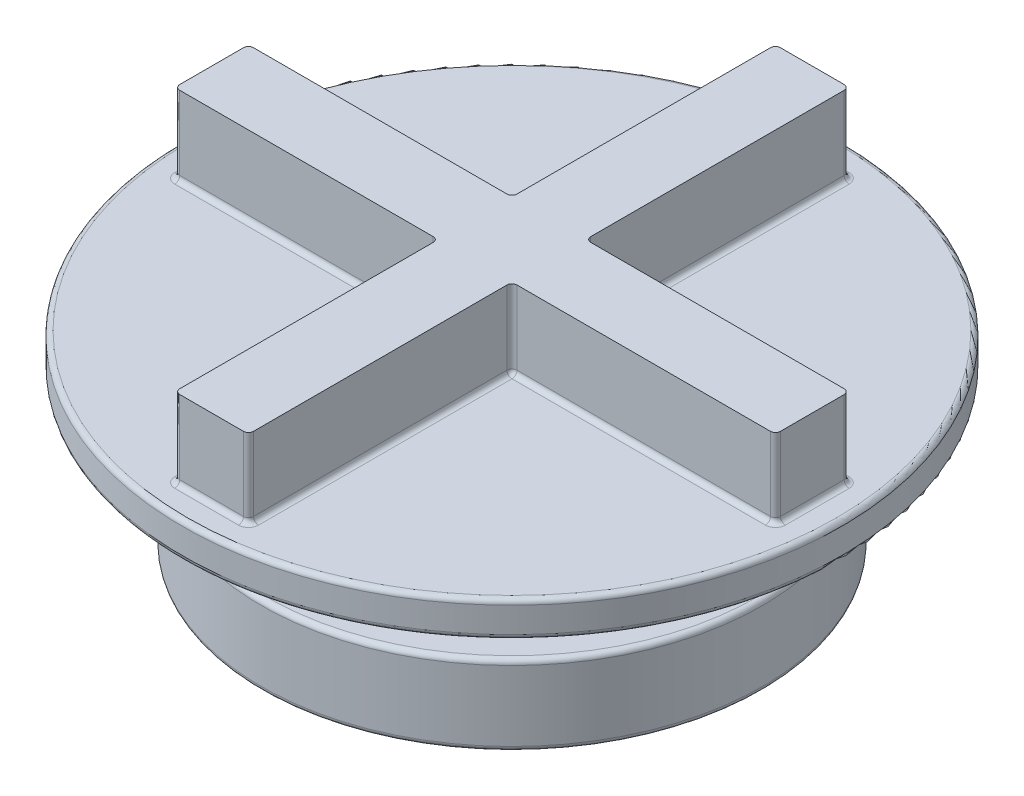
from build123d import *

# Parameters (mm, degrees)
MAIN_BODY_SKETCH_W                         = 18
MAIN_BODY_SKETCH_H                         = 53.33
HALF_MAIN_BODY_EXTRUDE_DEPTH               = 1.105
HALF_MAIN_BODY_COPY_ANGLE                  = 90
BOTTOM_BASE_SKETCH_R                       = 13
BOTTOM_BASE_EXTRUDE_DEPTH                  = 2.71
PROTRUSIONS_SKETCH_W                       = 1.88
PROTRUSIONS_SKETCH_H                       = 17.3
PROTRUSIONS_EXTRUDE_DEPTH                  = 0.97
PROTRUSIONS_SMOOTHING_R                    = 0.9
PROTRUSIONS_SMOOTHING_PLATFORM_R           = 0.1
LPATTERN1_COUNT                            = 3
LPATTERN1_PITCH                            = 3.76
PROTRUSIONS_SMOOTHING_OF_LPATTERN1_R       = 0.9
PROTRUSIONS_SMOOTHING_PLATFORM_OF_LPATTE_R = 0.1
LPATTERN1_COL_COUNT                        = 3
LPATTERN1_COL_PITCH                        = 3.76
PROTRUSIONS_SMOOTHING_OF_LPATTERN1_COL_R   = 0.9
PROTRUSIONS_SMOOTHING_PLATFORM_OF_LP_2_R   = 0.1
TOP_BASE_SKETCH_R                          = 9.875
TOP_BASE_EXTRUDE_DEPTH                     = 1.06
TOP_INTERMEDIATE_SKETCH_R                  = 5.99
TOP_INTERMEDIATE_BASE_EXTRUDE_DEPTH        = 2.18
OUTER_BASE_SKETCH_R                        = 7.505
OUTER_BASE_EXTRUDE_DEPTH                   = 2.4
SMOOTHING_FILLETS_R                        = 0.15
SKETCH2_W                                  = 38.243274693
SKETCH2_H                                  = 31.26110006
CUT_EXTRUDE1_DEPTH                         = 58.65953968


with BuildPart() as part:
    # Main Body Sketch → Half Main Body Extrude (new, symmetric)
    with BuildSketch(Plane.XY):
        Rectangle(MAIN_BODY_SKETCH_W, MAIN_BODY_SKETCH_H)
    extrude(amount=HALF_MAIN_BODY_EXTRUDE_DEPTH, both=True)


with BuildPart() as body_2:
    # Half Main Body Copy: copy of part
    add(part.part.rotate(Axis((0, 0, 0), (0, 1, 0)), HALF_MAIN_BODY_COPY_ANGLE))


with BuildPart() as part_1:
    add(part.part)

    add(body_2.part)  # Bottom Base Extrude merges body 2
    # Bottom Base Sketch → Bottom Base Extrude (add)
    with BuildSketch(Plane(origin=(0, 26.665, 0), x_dir=(1, 0, 0), z_dir=(0, 1, 0))):
        with Locations(Location((0, 0, 0), (0, 0, 270))):
            Circle(BOTTOM_BASE_SKETCH_R)
    extrude(amount=BOTTOM_BASE_EXTRUDE_DEPTH)

    # Protrusions Sketch → Protrusions Extrude (add)
    with BuildSketch(Plane(origin=(0, 29.375, 0), x_dir=(1, 0, 0), z_dir=(0, 1, 0))):
        Rectangle(PROTRUSIONS_SKETCH_W, PROTRUSIONS_SKETCH_H)
    protrusions_extrude = extrude(amount=PROTRUSIONS_EXTRUDE_DEPTH)

    # Protrusions Smoothing
    protrusions_smoothing_edges = [part_1.edges().sort_by_distance(p)[0] for p in [
        (0, 30.345, -8.65),
        (0.94, 29.86, -8.65),
        (-0.94, 30.345, 0),
        (-0.94, 29.86, -8.65),
        (-0.94, 29.86, 8.65),
        (0.94, 29.86, 8.65),
        (0, 30.345, 8.65),
        (0.94, 30.345, 0),
    ]]
    fillet(protrusions_smoothing_edges, radius=PROTRUSIONS_SMOOTHING_R)

    # Protrusions Smoothing Platform
    protrusions_smoothing_platform_edges = [part_1.edges().sort_by_distance(p)[0] for p in [
        (0, 29.375, 8.65),
        (0, 29.375, -8.65),
        (0.676396103, 29.375, -8.386396103),
        (0.94, 29.375, 0),
        (0.676396103, 29.375, 8.386396103),
        (-0.676396103, 29.375, -8.386396103),
        (-0.676396103, 29.375, 8.386396103),
        (-0.94, 29.375, 0),
    ]]
    fillet(protrusions_smoothing_platform_edges, radius=PROTRUSIONS_SMOOTHING_PLATFORM_R)

    # LPattern1: Protrusions Extrude ×3
    with Locations(*[(i * LPATTERN1_PITCH, 0, 0) for i in range(1, LPATTERN1_COUNT)]):
        add(protrusions_extrude)

    # Protrusions Smoothing of LPattern1
    protrusions_smoothing_of_lpattern1_edges = [part_1.edges().sort_by_distance(p)[0] for p in [
        (3.76, 30.345, -8.65),
        (4.7, 29.86, -8.65),
        (2.82, 30.345, 0),
        (2.82, 29.86, -8.65),
        (2.82, 29.86, 8.65),
        (4.7, 29.86, 8.65),
        (3.76, 30.345, 8.65),
        (4.7, 30.345, 0),
        (7.52, 30.345, -8.65),
        (8.46, 29.86, -8.65),
        (6.58, 30.345, 0),
        (6.58, 29.86, -8.65),
        (6.58, 29.86, 8.65),
        (8.46, 29.86, 8.65),
        (7.52, 30.345, 8.65),
        (8.46, 30.345, 0),
    ]]
    fillet(protrusions_smoothing_of_lpattern1_edges, radius=PROTRUSIONS_SMOOTHING_OF_LPATTERN1_R)

    # Protrusions Smoothing Platform of LPatte
    protrusions_smoothing_platform_of_lpatte_edges = [part_1.edges().sort_by_distance(p)[0] for p in [
        (3.76, 29.375, 8.65),
        (3.76, 29.375, -8.65),
        (4.436396103, 29.375, -8.386396103),
        (4.7, 29.375, 0),
        (4.436396103, 29.375, 8.386396103),
        (3.083603897, 29.375, -8.386396103),
        (3.083603897, 29.375, 8.386396103),
        (2.82, 29.375, 0),
        (7.52, 29.375, 8.65),
        (7.52, 29.375, -8.65),
        (8.196396103, 29.375, -8.386396103),
        (8.46, 29.375, 0),
        (8.196396103, 29.375, 8.386396103),
        (6.843603897, 29.375, -8.386396103),
        (6.843603897, 29.375, 8.386396103),
        (6.58, 29.375, 0),
    ]]
    fillet(protrusions_smoothing_platform_of_lpatte_edges, radius=PROTRUSIONS_SMOOTHING_PLATFORM_OF_LPATTE_R)

    # LPattern1 col: Protrusions Extrude ×3
    with Locations(*[(-i * LPATTERN1_COL_PITCH, 0, 0) for i in range(1, LPATTERN1_COL_COUNT)]):
        add(protrusions_extrude)

    # Protrusions Smoothing of LPattern1 col
    protrusions_smoothing_of_lpattern1_col_edges = [part_1.edges().sort_by_distance(p)[0] for p in [
        (-3.76, 30.345, -8.65),
        (-2.82, 29.86, -8.65),
        (-4.7, 30.345, 0),
        (-4.7, 29.86, -8.65),
        (-4.7, 29.86, 8.65),
        (-2.82, 29.86, 8.65),
        (-3.76, 30.345, 8.65),
        (-2.82, 30.345, 0),
        (-7.52, 30.345, -8.65),
        (-6.58, 29.86, -8.65),
        (-8.46, 30.345, 0),
        (-8.46, 29.86, -8.65),
        (-8.46, 29.86, 8.65),
        (-6.58, 29.86, 8.65),
        (-7.52, 30.345, 8.65),
        (-6.58, 30.345, 0),
    ]]
    fillet(protrusions_smoothing_of_lpattern1_col_edges, radius=PROTRUSIONS_SMOOTHING_OF_LPATTERN1_COL_R)

    # Protrusions Smoothing Platform of LP 2
    protrusions_smoothing_platform_of_lp_2_edges = [part_1.edges().sort_by_distance(p)[0] for p in [
        (-3.76, 29.375, 8.65),
        (-3.76, 29.375, -8.65),
        (-3.083603897, 29.375, -8.386396103),
        (-2.82, 29.375, 0),
        (-3.083603897, 29.375, 8.386396103),
        (-4.436396103, 29.375, -8.386396103),
        (-4.436396103, 29.375, 8.386396103),
        (-4.7, 29.375, 0),
        (-7.52, 29.375, 8.65),
        (-7.52, 29.375, -8.65),
        (-6.843603897, 29.375, -8.386396103),
        (-6.58, 29.375, 0),
        (-6.843603897, 29.375, 8.386396103),
        (-8.196396103, 29.375, -8.386396103),
        (-8.196396103, 29.375, 8.386396103),
        (-8.46, 29.375, 0),
    ]]
    fillet(protrusions_smoothing_platform_of_lp_2_edges, radius=PROTRUSIONS_SMOOTHING_PLATFORM_OF_LP_2_R)

    # Top Base Sketch → Top Base Extrude (add)
    with BuildSketch(Plane(origin=(0, -26.665, 0), x_dir=(-1, 0, 0), z_dir=(0, -1, 0))):
        with Locations(Location((0, 0, 0), (0, 0, 90))):
            Circle(TOP_BASE_SKETCH_R)
    extrude(amount=TOP_BASE_EXTRUDE_DEPTH)

    # Top Intermediate Sketch → Top Intermediate Base Extrude (add)
    with BuildSketch(Plane(origin=(0, -27.725, 0), x_dir=(-1, 0, 0), z_dir=(0, -1, 0))):
        with Locations(Location((0, 0, 0), (0, 0, 90))):
            Circle(TOP_INTERMEDIATE_SKETCH_R)
    extrude(amount=TOP_INTERMEDIATE_BASE_EXTRUDE_DEPTH)

    # Outer Base Sketch → Outer Base Extrude (add)
    with BuildSketch(Plane(origin=(0, -29.905, 0), x_dir=(-1, 0, 0), z_dir=(0, -1, 0))):
        with Locations(Location((0, 0, 0), (0, 0, 90))):
            Circle(OUTER_BASE_SKETCH_R)
    extrude(amount=OUTER_BASE_EXTRUDE_DEPTH)

    # Smoothing Fillets
    smoothing_fillets_edges = [part_1.edges().sort_by_distance(p)[0] for p in [
        (9, 0, 1.105),
        (0, 26.665, -13),
        (0, 29.375, -13),
        (-5.0525, -26.665, 1.105),
        (5.0525, 26.665, -1.105),
        (5.0525, 26.665, 1.105),
        (-1.105, 26.665, -5.0525),
        (1.105, 26.665, -5.0525),
        (5.0525, -26.665, -1.105),
        (5.0525, -26.665, 1.105),
        (0, -26.665, 9.875),
        (0, -27.725, 9.875),
        (0, -29.905, 7.505),
        (0, -32.305, 7.505),
        (-1.105, -26.665, 5.0525),
        (0, -26.665, 9),
        (1.105, 26.665, 5.0525),
        (1.105, -26.665, 5.0525),
        (1.105, 0, 1.105),
        (1.105, 0, -1.105),
        (-1.105, 0, 9),
        (-1.105, 26.665, 5.0525),
        (-1.105, 0, 1.105),
        (1.105, 0, 9),
        (0, 26.665, 9),
        (-1.105, -26.665, -5.0525),
        (-1.105, 0, -9),
        (0, -26.665, -9),
        (0, 26.665, -9),
        (1.105, -26.665, -5.0525),
        (1.105, 0, -9),
        (-1.105, 0, -1.105),
        (-9, 0, 1.105),
        (-5.0525, -26.665, -1.105),
        (9, 0, -1.105),
        (-5.0525, 26.665, -1.105),
        (-9, 0, -1.105),
        (-9, -26.665, 0),
        (9, -26.665, 0),
        (9, 26.665, 0),
        (-9, 26.665, 0),
        (-5.0525, 26.665, 1.105),
    ]]
    fillet(smoothing_fillets_edges, radius=SMOOTHING_FILLETS_R)

    # Sketch2 → Cut-Extrude1 (cut, through all)
    with BuildSketch(Plane(origin=(0, -24.305, 0), x_dir=(-1, 0, 0), z_dir=(0, -1, 0))):
        with Locations((-0.207424694, -0.017113173)):
            Rectangle(SKETCH2_W, SKETCH2_H)
    extrude(amount=-CUT_EXTRUDE1_DEPTH, mode=Mode.SUBTRACT)


solid = part_1.part
